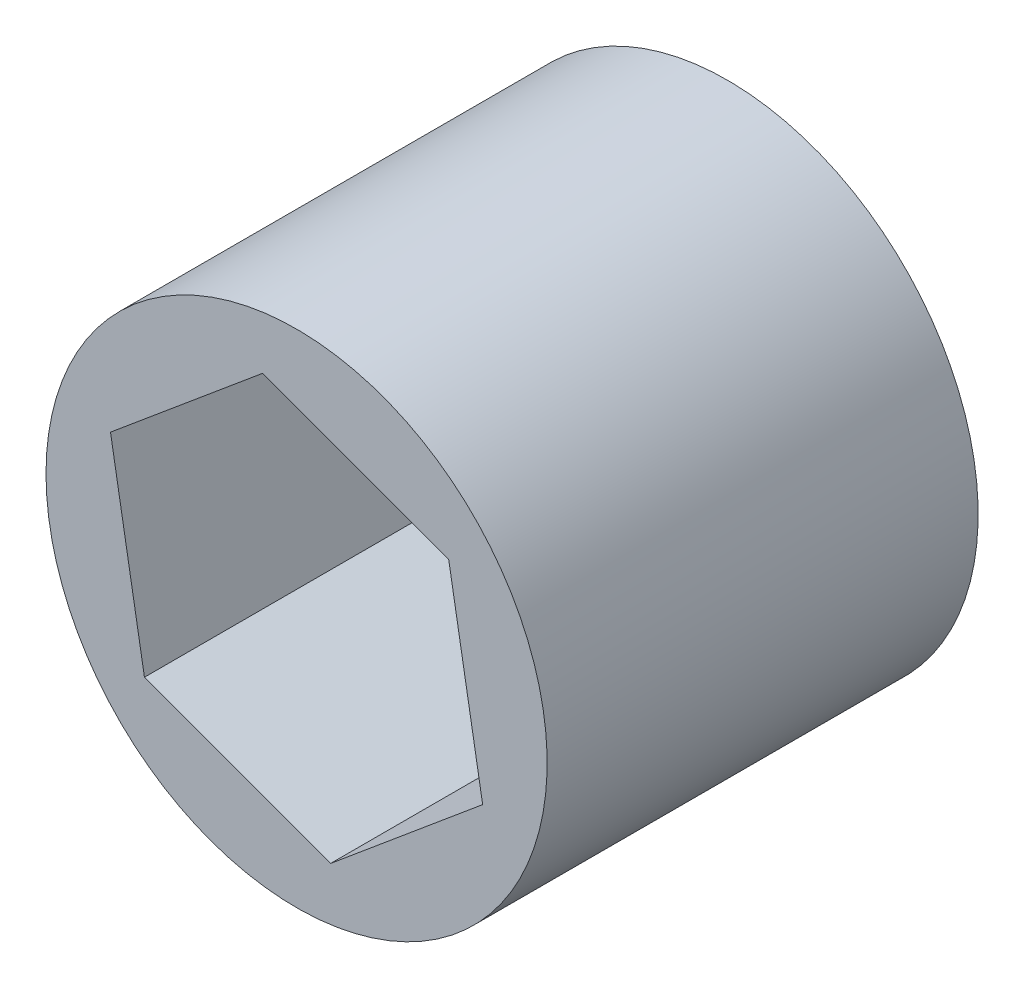
from build123d import *

# Parameters (mm, degrees)
SKETCH1_R           = 10
BOSS_EXTRUDE1_DEPTH = 17.2


with BuildPart() as part:
    # Sketch1 → Boss-Extrude1 (new body)
    with BuildSketch(Plane.XY):
        with Locations(Location((0, 0, 0), (0, 0, 180))):
            Circle(SKETCH1_R)
        Polygon((-7.426228764, 2.722950547), (-6.071258729, -5.06982749), (1.354970035, -7.792778037), (7.426228764, -2.722950547), (6.071258729, 5.06982749), (-1.354970035, 7.792778037), align=None, mode=Mode.SUBTRACT)
    extrude(amount=BOSS_EXTRUDE1_DEPTH)


solid = part.part
